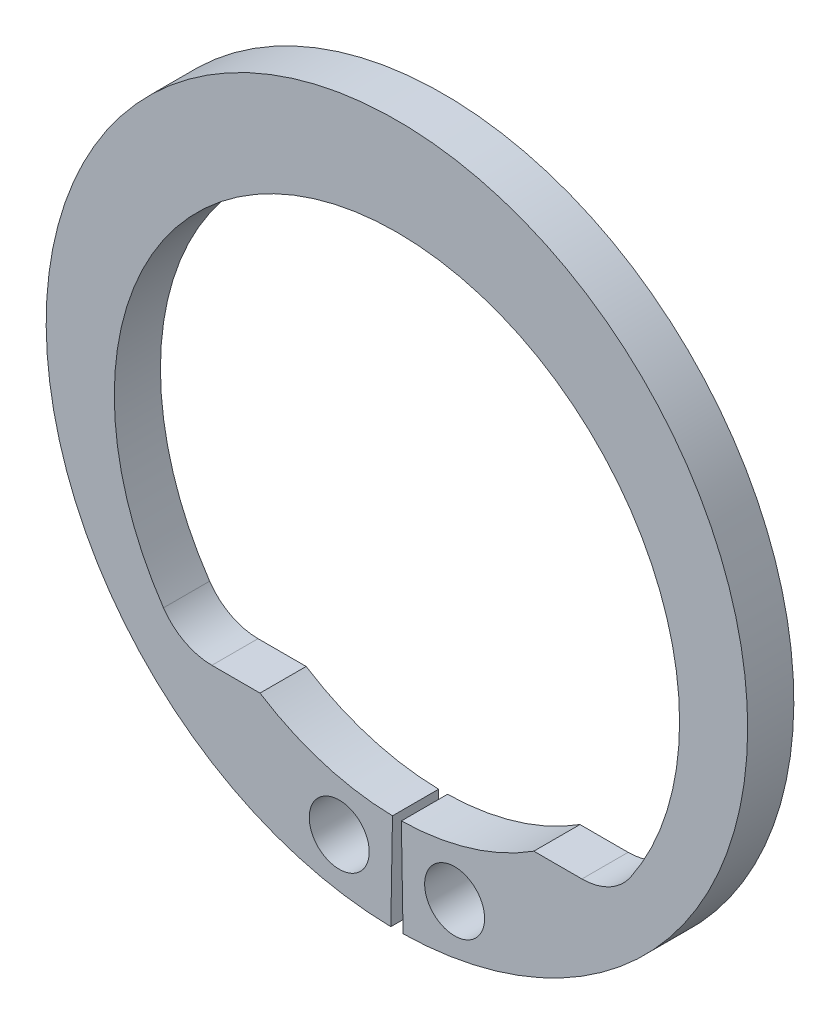
from build123d import *
from build123d.topology import SkipClean

# Parameters (mm, degrees)
SKETCH3_R           = 0.65
BOSS_EXTRUDE1_DEPTH = 0.5
FILLET1_R           = 1.27


with BuildPart() as part:
    # Sketch3 → Boss-Extrude1 (new, symmetric)
    with BuildSketch(Plane.XY):
        with BuildLine():
            Line((-2.9662687, -4.631549417), (-4.631549417, -4.631549417))
            ThreePointArc((-4.631549417, -4.631549417), (-5.569998734, 1.921865411), (0, 5.5))
            Line((0, 5.5), (0, 7.6))
            ThreePointArc((0, 7.6), (-7.599710615, 0.06632167), (-0.132638289, -7.598842483))
            Line((-0.132638289, -7.598842483), (-0.095988235, -5.499162323))
            ThreePointArc((-0.095988235, -5.499162323), (-1.591396375, -5.26473718), (-2.9662687, -4.631549417))
        make_face()
        with Locations((-1.24979892, -6.429658052)):
            Circle(SKETCH3_R, mode=Mode.SUBTRACT)
    extrude(amount=BOSS_EXTRUDE1_DEPTH, both=True)

    # Fillet1
    fillet1_edges = [part.edges().sort_by_distance(p)[0] for p in [
        (-4.631549417, -4.631549417, 0),
    ]]
    fillet(fillet1_edges, radius=FILLET1_R)

    # Mirror1: part across plane


with BuildPart() as part_1:
    with SkipClean():  # the faces are left unmerged after this step: merging them gives an invalid solid
        add(part.part)
        add(part.part.mirror(Plane(origin=(0, 0, 0), x_dir=(0, 0, 1), z_dir=(1, 0, 0))))


solid = part_1.part
